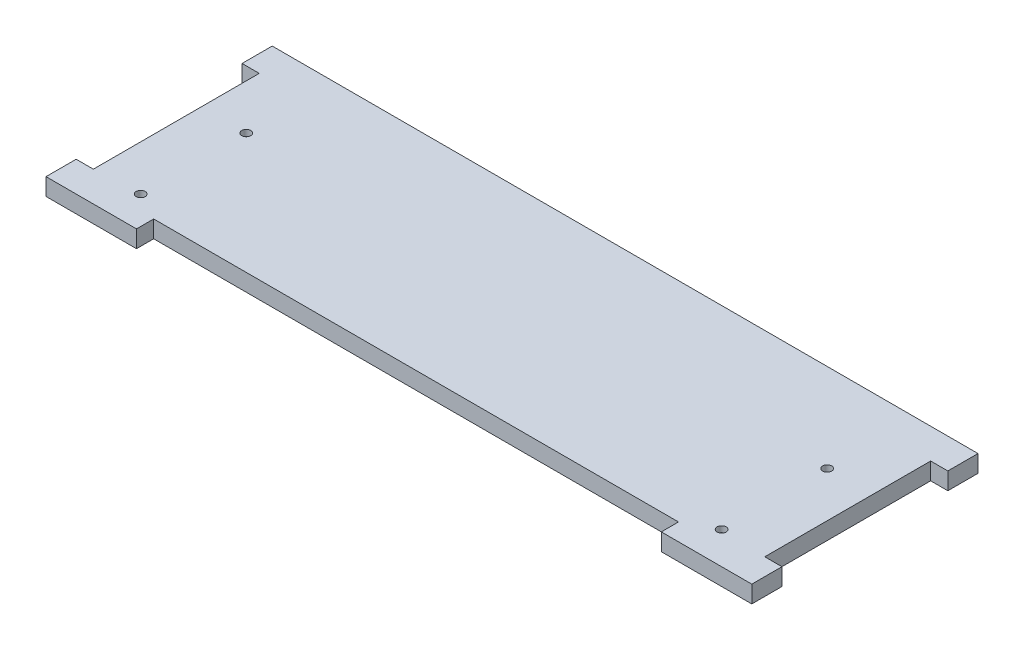
from build123d import *

# Parameters (mm, degrees)
SKETCH1_W           = 234
SKETCH1_H           = 75
BOSS_EXTRUDE1_DEPTH = 5.7
SKETCH2_W           = 5.7
SKETCH2_H           = 55
CUT_EXTRUDE1_DEPTH  = 5.7
SKETCH3_W           = 174
SKETCH3_H           = 5.7
CUT_EXTRUDE2_DEPTH  = 5.7
SKETCH4_R           = 1.5
CUT_EXTRUDE3_DEPTH  = 2


with BuildPart() as part:
    # Sketch1 → Boss-Extrude1 (new body)
    with BuildSketch(Plane(origin=(0, 0, 0), x_dir=(1, 0, 0), z_dir=(0, 1, 0))):
        with Locations((117, 37.5)):
            Rectangle(SKETCH1_W, SKETCH1_H)
    extrude(amount=BOSS_EXTRUDE1_DEPTH)

    # Sketch2 → Cut-Extrude1 (cut)
    with BuildSketch(Plane(origin=(0, 5.7, 0), x_dir=(1, 0, 0), z_dir=(0, 1, 0))):
        with Locations((2.85, 37.5)):
            Rectangle(SKETCH2_W, SKETCH2_H)
        with Locations((231.15, 37.5)):
            Rectangle(SKETCH2_W, SKETCH2_H)
    extrude(amount=-CUT_EXTRUDE1_DEPTH, mode=Mode.SUBTRACT)

    # Sketch3 → Cut-Extrude2 (cut)
    with BuildSketch(Plane(origin=(0, 5.7, 0), x_dir=(1, 0, 0), z_dir=(0, 1, 0))):
        with Locations((117, 2.85)):
            Rectangle(SKETCH3_W, SKETCH3_H)
    extrude(amount=-CUT_EXTRUDE2_DEPTH, mode=Mode.SUBTRACT)

    # Sketch4 → Cut-Extrude3 (cut)
    with BuildSketch(Plane(origin=(0, 5.7, 0), x_dir=(1, 0, 0), z_dir=(0, 1, 0))):
        with Locations(Location((213.3, 45.7, 0), (0, 0, 270))):
            Circle(SKETCH4_R)
        with Locations(Location((213.3, 10.7, 0), (0, 0, 270))):
            Circle(SKETCH4_R)
        with Locations(Location((20.7, 10.7, 0), (0, 0, 270))):
            Circle(SKETCH4_R)
        with Locations(Location((20.7, 45.7, 0), (0, 0, 270))):
            Circle(SKETCH4_R)
    extrude(amount=-CUT_EXTRUDE3_DEPTH, mode=Mode.SUBTRACT)


solid = part.part
